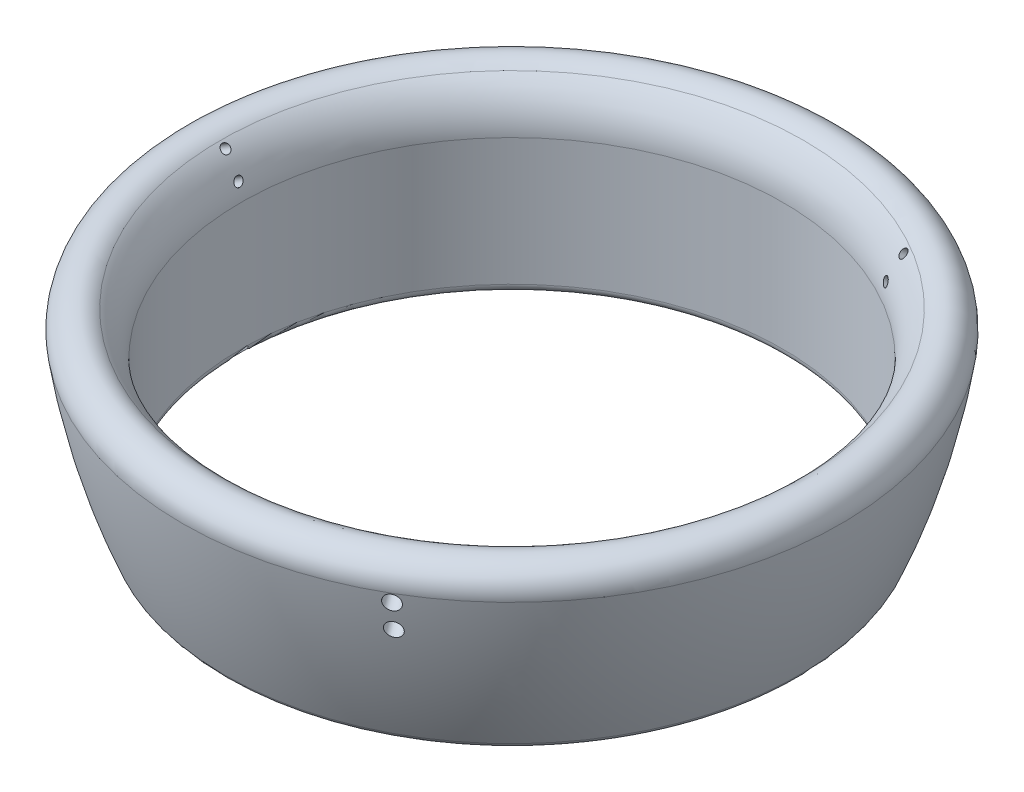
from build123d import *

# Parameters (mm, degrees)
HOLE1_D           = 10.5
HOLE1_DEPTH       = 695.85583999
HOLE1_CBORE_D     = 18
HOLE1_CBORE_DEPTH = 14.041071187
HOLE2_D           = 10.5
HOLE2_DEPTH       = 684.573489476
HOLE2_CBORE_D     = 18
HOLE2_CBORE_DEPTH = 14.455598506
HOLE3_D           = 10.5
HOLE3_DEPTH       = 805.450951732
HOLE3_CBORE_D     = 18
HOLE3_CBORE_DEPTH = 14.455598506
HOLE4_D           = 10.5
HOLE4_DEPTH       = 816.733302246
HOLE4_CBORE_D     = 18
HOLE4_CBORE_DEPTH = 14.041071187
HOLE5_D           = 10.5
HOLE5_DEPTH       = 805.450951732
HOLE5_CBORE_D     = 18
HOLE5_CBORE_DEPTH = 14.455598506
HOLE6_D           = 10.5
HOLE6_DEPTH       = 816.733302246
HOLE6_CBORE_D     = 18
HOLE6_CBORE_DEPTH = 14.041071187


with BuildPart() as part:
    # Sketch1 → Revolve1 (revolve)
    with BuildSketch(Plane(origin=(0, 0, 0), x_dir=(-1, 0, 0), z_dir=(0, 0, -1)), mode=Mode.PRIVATE) as revolve1_sk:
        with BuildLine():
            Line((-320, -150), (-320, 0))
            ThreePointArc((-320, 0), (-326.396652763, 28.395335039), (-344.350873885, 51.305118155))
            ThreePointArc((-344.350873885, 51.305118155), (-375.39529491, 53.86947194), (-388.917363548, 25.807297276))
            ThreePointArc((-388.917363548, 25.807297276), (-369.33551998, -65.431491935), (-339.262406499, -153.769326976))
            ThreePointArc((-339.262406499, -153.769326976), (-328.079591839, -159.813869395), (-320, -150))
        make_face()
        with BuildLine():
            Line((-330, -140), (-330, -150))
            Line((-330, -150), (-331.736481777, -140.15192247))
            ThreePointArc((-331.736481777, -140.15192247), (-330.871557427, -140.038053019), (-330, -140))
        make_face(mode=Mode.SUBTRACT)
    revolve(revolve1_sk.sketch.rotate(Axis((0, -160, 0), (0, 1, 0)), 270), axis=Axis((0, -160, 0), (0, 1, 0)))

    # Hole1
    with Locations(Plane(origin=(-284.343921253, -177.677801793, 0), x_dir=(0, 0, 1), z_dir=(-0.8480480961564313, -0.5299192642331966, 0))):
        with Locations((0, 187.987369502)):
            CounterBoreHole(HOLE1_D / 2, HOLE1_CBORE_D / 2, HOLE1_CBORE_DEPTH, depth=HOLE1_DEPTH)

    # Hole2
    with Locations(Plane(origin=(-274.775945379, -171.699066909, 0), x_dir=(0, 0, 1), z_dir=(-0.8480480961564314, -0.5299192642331965, 0))):
        with Locations((0, 217.987369502)):
            CounterBoreHole(HOLE2_D / 2, HOLE2_CBORE_D / 2, HOLE2_CBORE_DEPTH, depth=HOLE2_DEPTH)

    # Hole3
    with Locations(Plane(origin=(137.387972689, -171.699066909, 237.962949047), x_dir=(0.9056509298020752, 0.24810719470458223, -0.3438592928574992), z_dir=(0.4240240480782156, -0.5299192642331962, 0.7344311949024981))):
        with Locations((63.774961554, 208.449628307)):
            CounterBoreHole(HOLE3_D / 2, HOLE3_CBORE_D / 2, HOLE3_CBORE_DEPTH, depth=HOLE3_DEPTH)

    # Hole4
    with Locations(Plane(origin=(142.171960626, -177.677801793, 246.249059217), x_dir=(0.9056509298020752, 0.24810719470458223, -0.3438592928574992), z_dir=(0.4240240480782156, -0.5299192642331962, 0.7344311949024981))):
        with Locations((54.998082182, 179.762237549)):
            CounterBoreHole(HOLE4_D / 2, HOLE4_CBORE_D / 2, HOLE4_CBORE_DEPTH, depth=HOLE4_DEPTH)

    # Hole5
    with Locations(Plane(origin=(137.387972689, -171.699066909, -237.962949047), x_dir=(-0.905650929802075, -0.2481071947045825, -0.3438592928574996), z_dir=(0.4240240480782161, -0.529919264233196, -0.7344311949024981))):
        with Locations((-63.774961554, 208.449628307)):
            CounterBoreHole(HOLE5_D / 2, HOLE5_CBORE_D / 2, HOLE5_CBORE_DEPTH, depth=HOLE5_DEPTH)

    # Hole6
    with Locations(Plane(origin=(142.171960626, -177.677801793, -246.249059217), x_dir=(-0.905650929802075, -0.2481071947045825, -0.3438592928574996), z_dir=(0.4240240480782161, -0.529919264233196, -0.7344311949024981))):
        with Locations((-54.998082182, 179.762237549)):
            CounterBoreHole(HOLE6_D / 2, HOLE6_CBORE_D / 2, HOLE6_CBORE_DEPTH, depth=HOLE6_DEPTH)


solid = part.part
